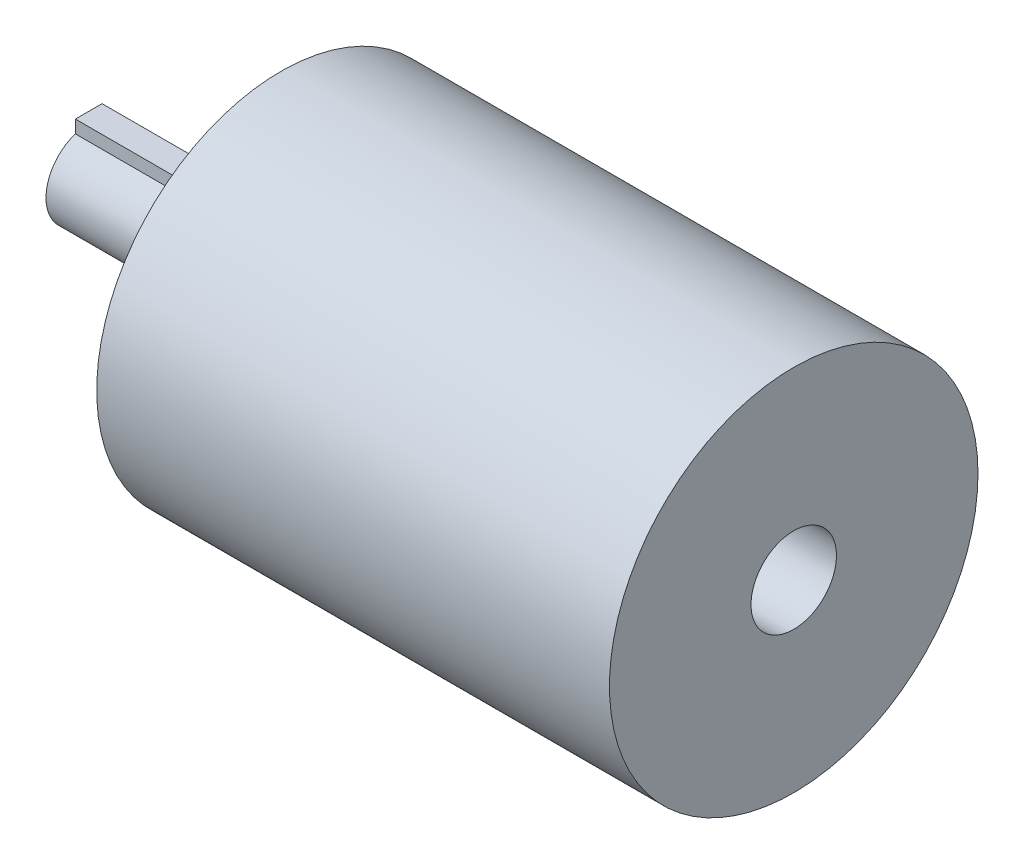
from build123d import *

# Parameters (mm, degrees)
BOSS_EXTRUDE1_DEPTH        = 10
BOSS_EXTRUDE1_DEPTH_BACK   = 36
BOSS_EXTRUDE2_START        = -4.5
SKETCH1_3_R                = 26
BOSS_EXTRUDE2_DEPTH        = 4.5
SKETCH1_4_R                = 34.5
SKETCH1_4_R_2              = 8
BOSS_EXTRUDE3_DEPTH        = 96
M5_TAPPED_HOLE1_AT_2_COUNT = 2
M5_TAPPED_HOLE1_AT_2_PITCH = 43.840620434
M5_TAPPED_HOLE1_AT_3_COUNT = 2
M5_TAPPED_HOLE1_AT_3_PITCH = 62
M5_TAPPED_HOLE1_AT_4_COUNT = 2
M5_TAPPED_HOLE1_AT_4_PITCH = 43.840620434


with BuildPart() as part:
    # Sketch1 → Boss-Extrude1 (new, two sides: drawn at the far end of the back side and taken through both)
    with BuildSketch(Plane(origin=(0, 0, 0), x_dir=(0, 0, -1), z_dir=(1, 0, 0)).offset(-BOSS_EXTRUDE1_DEPTH_BACK)):
        with BuildLine():
            Line((2.5, 7.599342077), (2.5, 10))
            Line((2.5, 10), (-2.5, 10))
            Line((-2.5, 10), (-2.5, 7.599342077))
            ThreePointArc((-2.5, 7.599342077), (0, -8), (2.5, 7.599342077))
        make_face()
    extrude(amount=BOSS_EXTRUDE1_DEPTH + BOSS_EXTRUDE1_DEPTH_BACK)

    # Sketch1<3> → Boss-Extrude2 (add)
    with BuildSketch(Plane(origin=(0, 0, 0), x_dir=(0, 0, -1), z_dir=(1, 0, 0)).offset(BOSS_EXTRUDE2_START)):
        Circle(SKETCH1_3_R)
        with BuildLine():
            Line((-2.5, 10), (2.5, 10))
            Line((2.5, 10), (2.5, 7.599342077))
            ThreePointArc((2.5, 7.599342077), (6.480740698, 4.69041576), (8, 0))
            ThreePointArc((8, 0), (-4.69041576, -6.480740698), (-2.5, 7.599342077))
            Line((-2.5, 7.599342077), (-2.5, 10))
        make_face(mode=Mode.SUBTRACT)
    extrude(amount=BOSS_EXTRUDE2_DEPTH)


with BuildPart() as body_2:
    # Sketch1<4> → Boss-Extrude3 (new body)
    with BuildSketch(Plane(origin=(0, 0, 0), x_dir=(0, 0, -1), z_dir=(1, 0, 0))):
        Circle(SKETCH1_4_R)
        Circle(SKETCH1_4_R_2, mode=Mode.SUBTRACT)
    extrude(amount=BOSS_EXTRUDE3_DEPTH)

    # Sketch3 → M5 Tapped Hole1 (revolve, cut)
    with BuildSketch(Plane.ZX.offset(31)):
        Polygon((0, 0), (0, 13.6618073), (2.1, 12.4), (2.1, 0), align=None)
    m5_tapped_hole1 = revolve(axis=Axis((-6.35, 31, 0), (1, 0, 0)), mode=Mode.SUBTRACT)

    # M5 Tapped Hole1 at 2: M5 Tapped Hole1 ×2
    with Locations(*[Vector(0, -0.7071067811865476, -0.7071067811865476) * (i * M5_TAPPED_HOLE1_AT_2_PITCH) for i in range(1, M5_TAPPED_HOLE1_AT_2_COUNT)]):
        add(m5_tapped_hole1, mode=Mode.SUBTRACT)

    # M5 Tapped Hole1 at 3: M5 Tapped Hole1 ×2
    with Locations(*[(0, -i * M5_TAPPED_HOLE1_AT_3_PITCH, 0) for i in range(1, M5_TAPPED_HOLE1_AT_3_COUNT)]):
        add(m5_tapped_hole1, mode=Mode.SUBTRACT)

    # M5 Tapped Hole1 at 4: M5 Tapped Hole1 ×2
    with Locations(*[Vector(0, -0.7071067811865476, 0.7071067811865476) * (i * M5_TAPPED_HOLE1_AT_4_PITCH) for i in range(1, M5_TAPPED_HOLE1_AT_4_COUNT)]):
        add(m5_tapped_hole1, mode=Mode.SUBTRACT)


solid = Compound([part.part, body_2.part])
